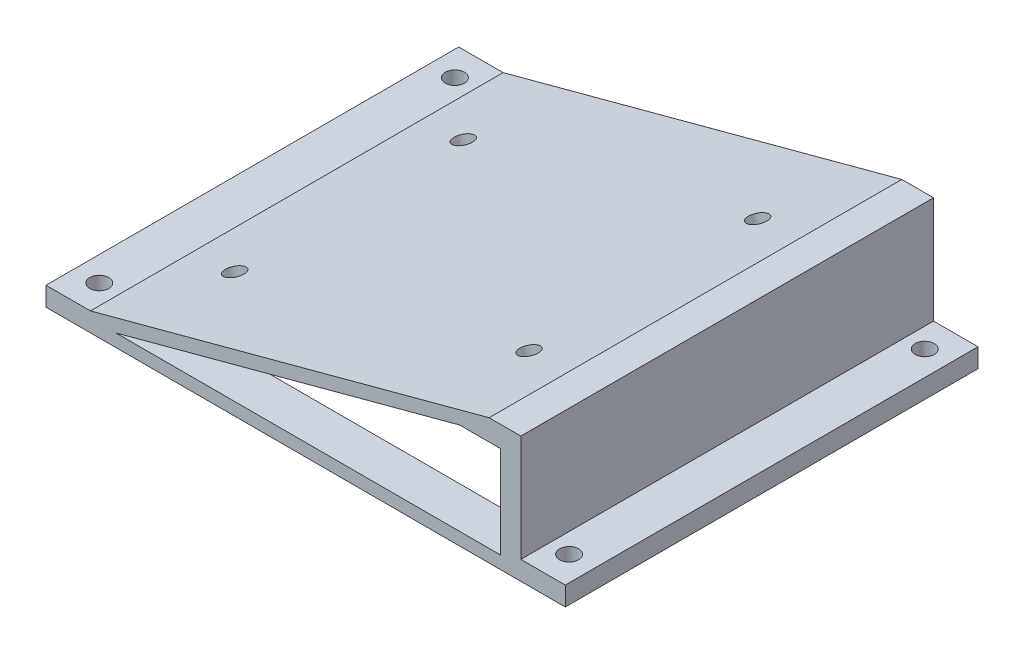
from build123d import *

# Parameters (mm, degrees)
EXTRUDE_4_DEPTH     = 65
CUT_EXTRUDE_2_DEPTH = 24.5
CUT_EXTRUDE_3_DEPTH = 24.5
CUT_EXTRUDE_5_REACH = 108.333
SKETCH_11_R         = 1.5
SKETCH_11_W         = 60.605178709
SKETCH_11_H         = 18
CUT_EXTRUDE_4_REACH = 108.359
SKETCH_8_R          = 1.5


with BuildPart() as part:
    # 草图1 → 凸台-拉伸4 (new body)
    with BuildSketch(Plane.XY):
        Polygon((0, 0), (0, 3), (7, 3), (69.785178709, 19.823237932), (74.785178709, 19.823237932), (74.785178709, 3), (81.785178709, 3), (81.785178709, 0), align=None)
    extrude(amount=EXTRUDE_4_DEPTH)

    # 草图9 → 切除-拉伸2 (cut)
    with BuildSketch(Plane.XY.offset(65)):
        Polygon((65.110092512, 16.5), (10.995355803, 2), (71.610092512, 2), (71.610092512, 16.5), align=None)
    extrude(amount=-CUT_EXTRUDE_2_DEPTH, mode=Mode.SUBTRACT)

    # 草图10 → 切除-拉伸3 (cut)
    with BuildSketch(Plane(origin=(0, 0, 0), x_dir=(-1, 0, 0), z_dir=(0, 0, -1))):
        Polygon((-71.610092512, 2), (-10.995355803, 2), (-65.110092512, 16.5), (-71.610092512, 16.5), align=None)
    extrude(amount=-CUT_EXTRUDE_3_DEPTH, mode=Mode.SUBTRACT)

    # 草图11 → 切除-拉伸5 (cut, up to next)
    with BuildSketch(Plane.XZ, mode=Mode.PRIVATE) as cut_extrude_5_sk1:
        with Locations(Location((3.892589354, 60.5, 0), (0, 0, 270))):
            Circle(SKETCH_11_R)
    cut_extrude_5_tool1 = extrude(cut_extrude_5_sk1.sketch, amount=-CUT_EXTRUDE_5_REACH, mode=Mode.PRIVATE) & part.part
    # 草图11 → 切除-拉伸5 (cut, up to next)
    with BuildSketch(Plane.XZ, mode=Mode.PRIVATE) as cut_extrude_5_sk2:
        with Locations(Location((77.892589354, 60.5, 0), (0, 0, 270))):
            Circle(SKETCH_11_R)
    cut_extrude_5_tool2 = extrude(cut_extrude_5_sk2.sketch, amount=-CUT_EXTRUDE_5_REACH, mode=Mode.PRIVATE) & part.part
    # 草图11 → 切除-拉伸5 (cut, up to next)
    with BuildSketch(Plane.XZ, mode=Mode.PRIVATE) as cut_extrude_5_sk3:
        with Locations(Location((77.892589354, 4.5, 0), (0, 0, 270))):
            Circle(SKETCH_11_R)
    cut_extrude_5_tool3 = extrude(cut_extrude_5_sk3.sketch, amount=-CUT_EXTRUDE_5_REACH, mode=Mode.PRIVATE) & part.part
    # 草图11 → 切除-拉伸5 (cut, up to next)
    with BuildSketch(Plane.XZ, mode=Mode.PRIVATE) as cut_extrude_5_sk4:
        with Locations(Location((3.892589354, 4.5, 0), (0, 0, 270))):
            Circle(SKETCH_11_R)
    cut_extrude_5_tool4 = extrude(cut_extrude_5_sk4.sketch, amount=-CUT_EXTRUDE_5_REACH, mode=Mode.PRIVATE) & part.part
    # 草图11 → 切除-拉伸5 (cut, up to next)
    with BuildSketch(Plane.XZ, mode=Mode.PRIVATE) as cut_extrude_5_sk5:
        with Locations((41.302589355, 49.5)):
            Rectangle(SKETCH_11_W, SKETCH_11_H)
    cut_extrude_5_tool5 = extrude(cut_extrude_5_sk5.sketch, amount=-CUT_EXTRUDE_5_REACH, mode=Mode.PRIVATE) & part.part
    # 草图11 → 切除-拉伸5 (cut, up to next)
    with BuildSketch(Plane.XZ, mode=Mode.PRIVATE) as cut_extrude_5_sk6:
        with Locations((41.302589355, 15.5)):
            Rectangle(SKETCH_11_W, SKETCH_11_H)
    cut_extrude_5_tool6 = extrude(cut_extrude_5_sk6.sketch, amount=-CUT_EXTRUDE_5_REACH, mode=Mode.PRIVATE) & part.part
    add(cut_extrude_5_tool1.solids().sort_by_distance((3.892589, 0, 60.5))[0], mode=Mode.SUBTRACT)
    add(cut_extrude_5_tool2.solids().sort_by_distance((77.892589, 0, 60.5))[0], mode=Mode.SUBTRACT)
    add(cut_extrude_5_tool3.solids().sort_by_distance((77.892589, 0, 4.5))[0], mode=Mode.SUBTRACT)
    add(cut_extrude_5_tool4.solids().sort_by_distance((3.892589, 0, 4.5))[0], mode=Mode.SUBTRACT)
    add(cut_extrude_5_tool5.solids().sort_by_distance((41.302589, 0, 49.5))[0], mode=Mode.SUBTRACT)
    add(cut_extrude_5_tool6.solids().sort_by_distance((41.302589, 0, 15.5))[0], mode=Mode.SUBTRACT)

    # 草图8 → 切除-拉伸4 (cut, up to next)
    with BuildSketch(Plane(origin=(-0.281088913, 1.049038106, 0), x_dir=(0.9659258262890681, 0.25881904510252157, 0), z_dir=(-0.25881904510252157, 0.9659258262890681, 0)), mode=Mode.PRIVATE) as cut_extrude_4_sk1:
        with Locations(Location((16.037937919, -14.5, 0), (0, 0, 180))):
            Circle(SKETCH_8_R)
    cut_extrude_4_tool1 = extrude(cut_extrude_4_sk1.sketch, amount=-CUT_EXTRUDE_4_REACH, mode=Mode.PRIVATE) & part.part
    # 草图8 → 切除-拉伸4 (cut, up to next)
    with BuildSketch(Plane(origin=(-0.281088913, 1.049038106, 0), x_dir=(0.9659258262890681, 0.25881904510252157, 0), z_dir=(-0.25881904510252157, 0.9659258262890681, 0)), mode=Mode.PRIVATE) as cut_extrude_4_sk2:
        with Locations(Location((64.037937919, -14.5, 0), (0, 0, 180))):
            Circle(SKETCH_8_R)
    cut_extrude_4_tool2 = extrude(cut_extrude_4_sk2.sketch, amount=-CUT_EXTRUDE_4_REACH, mode=Mode.PRIVATE) & part.part
    # 草图8 → 切除-拉伸4 (cut, up to next)
    with BuildSketch(Plane(origin=(-0.281088913, 1.049038106, 0), x_dir=(0.9659258262890681, 0.25881904510252157, 0), z_dir=(-0.25881904510252157, 0.9659258262890681, 0)), mode=Mode.PRIVATE) as cut_extrude_4_sk3:
        with Locations(Location((64.037937919, -50.5, 0), (0, 0, 180))):
            Circle(SKETCH_8_R)
    cut_extrude_4_tool3 = extrude(cut_extrude_4_sk3.sketch, amount=-CUT_EXTRUDE_4_REACH, mode=Mode.PRIVATE) & part.part
    # 草图8 → 切除-拉伸4 (cut, up to next)
    with BuildSketch(Plane(origin=(-0.281088913, 1.049038106, 0), x_dir=(0.9659258262890681, 0.25881904510252157, 0), z_dir=(-0.25881904510252157, 0.9659258262890681, 0)), mode=Mode.PRIVATE) as cut_extrude_4_sk4:
        with Locations(Location((16.037937919, -50.5, 0), (0, 0, 180))):
            Circle(SKETCH_8_R)
    cut_extrude_4_tool4 = extrude(cut_extrude_4_sk4.sketch, amount=-CUT_EXTRUDE_4_REACH, mode=Mode.PRIVATE) & part.part
    add(cut_extrude_4_tool1.solids().sort_by_distance((15.21037, 5.199962, 14.5))[0], mode=Mode.SUBTRACT)
    add(cut_extrude_4_tool2.solids().sort_by_distance((61.574809, 17.623276, 14.5))[0], mode=Mode.SUBTRACT)
    add(cut_extrude_4_tool3.solids().sort_by_distance((61.574809, 17.623276, 50.5))[0], mode=Mode.SUBTRACT)
    add(cut_extrude_4_tool4.solids().sort_by_distance((15.21037, 5.199962, 50.5))[0], mode=Mode.SUBTRACT)


solid = part.part
